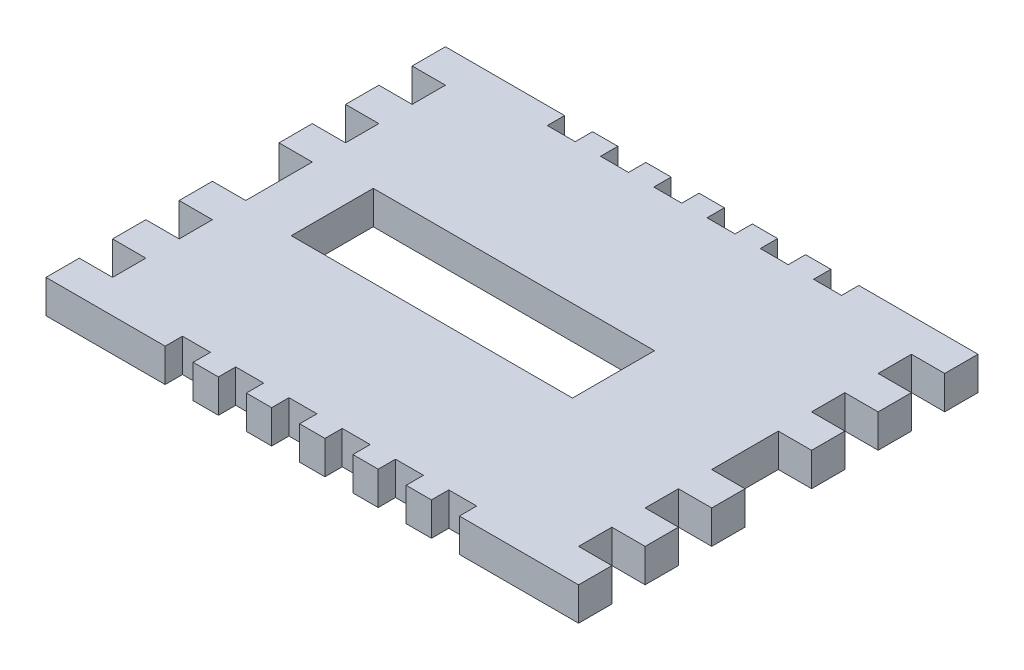
from build123d import *

# Parameters (mm, degrees)
SKETCH1_W           = 88.9
SKETCH1_H           = 76.2
SKETCH1_W_2         = 53.65
SKETCH1_H_2         = 15.65
BOSS_EXTRUDE1_DEPTH = 6.35
SKETCH2_W           = 5.334
SKETCH2_H           = 3.302
CUT_EXTRUDE1_DEPTH  = 59.887477446
SKETCH3_W           = 6.35
SKETCH3_H           = 6.35
BOSS_EXTRUDE2_DEPTH = 6.35


with BuildPart() as part:
    # Sketch1 → Boss-Extrude1 (new body)
    with BuildSketch(Plane(origin=(0, 0, 0), x_dir=(1, 0, 0), z_dir=(0, 1, 0))):
        Rectangle(SKETCH1_W, SKETCH1_H)
        with Locations((-7.465, 0)):
            Rectangle(SKETCH1_W_2, SKETCH1_H_2, mode=Mode.SUBTRACT)
    extrude(amount=BOSS_EXTRUDE1_DEPTH)

    # Sketch2 → Cut-Extrude1 (cut, through all)
    with BuildSketch(Plane(origin=(0, 0, 0), x_dir=(1, 0, 0), z_dir=(0, 1, 0))):
        with Locations((-25.4, -36.449)):
            Rectangle(SKETCH2_W, SKETCH2_H)
        with Locations((-15.24, -36.449)):
            Rectangle(SKETCH2_W, SKETCH2_H)
        with Locations((-5.08, -36.449)):
            Rectangle(SKETCH2_W, SKETCH2_H)
        with Locations((5.08, -36.449)):
            Rectangle(SKETCH2_W, SKETCH2_H)
        with Locations((15.24, -36.449)):
            Rectangle(SKETCH2_W, SKETCH2_H)
        with Locations((25.4, -36.449)):
            Rectangle(SKETCH2_W, SKETCH2_H)
        with Locations((25.4, 36.449)):
            Rectangle(SKETCH2_W, SKETCH2_H)
        with Locations((15.24, 36.449)):
            Rectangle(SKETCH2_W, SKETCH2_H)
        with Locations((5.08, 36.449)):
            Rectangle(SKETCH2_W, SKETCH2_H)
        with Locations((-5.08, 36.449)):
            Rectangle(SKETCH2_W, SKETCH2_H)
        with Locations((-15.24, 36.449)):
            Rectangle(SKETCH2_W, SKETCH2_H)
        with Locations((-25.4, 36.449)):
            Rectangle(SKETCH2_W, SKETCH2_H)
    extrude(amount=CUT_EXTRUDE1_DEPTH, mode=Mode.SUBTRACT)

    # Sketch3 → Boss-Extrude2 (add)
    with BuildSketch(Plane(origin=(0, 6.35, 0), x_dir=(1, 0, 0), z_dir=(0, 1, 0))):
        with Locations((-47.625, 34.925)):
            Rectangle(SKETCH3_W, SKETCH3_H)
        with Locations((-47.625, 22.225)):
            Rectangle(SKETCH3_W, SKETCH3_H)
        with Locations((-47.625, 9.525)):
            Rectangle(SKETCH3_W, SKETCH3_H)
        with Locations((-47.625, -9.525)):
            Rectangle(SKETCH3_W, SKETCH3_H)
        with Locations((-47.625, -22.225)):
            Rectangle(SKETCH3_W, SKETCH3_H)
        with Locations((-47.625, -34.925)):
            Rectangle(SKETCH3_W, SKETCH3_H)
        with Locations((47.625, -34.925)):
            Rectangle(SKETCH3_W, SKETCH3_H)
        with Locations((47.625, -22.225)):
            Rectangle(SKETCH3_W, SKETCH3_H)
        with Locations((47.625, -9.525)):
            Rectangle(SKETCH3_W, SKETCH3_H)
        with Locations((47.625, 9.525)):
            Rectangle(SKETCH3_W, SKETCH3_H)
        with Locations((47.625, 22.225)):
            Rectangle(SKETCH3_W, SKETCH3_H)
        with Locations((47.625, 34.925)):
            Rectangle(SKETCH3_W, SKETCH3_H)
    extrude(amount=-BOSS_EXTRUDE2_DEPTH)


solid = part.part
